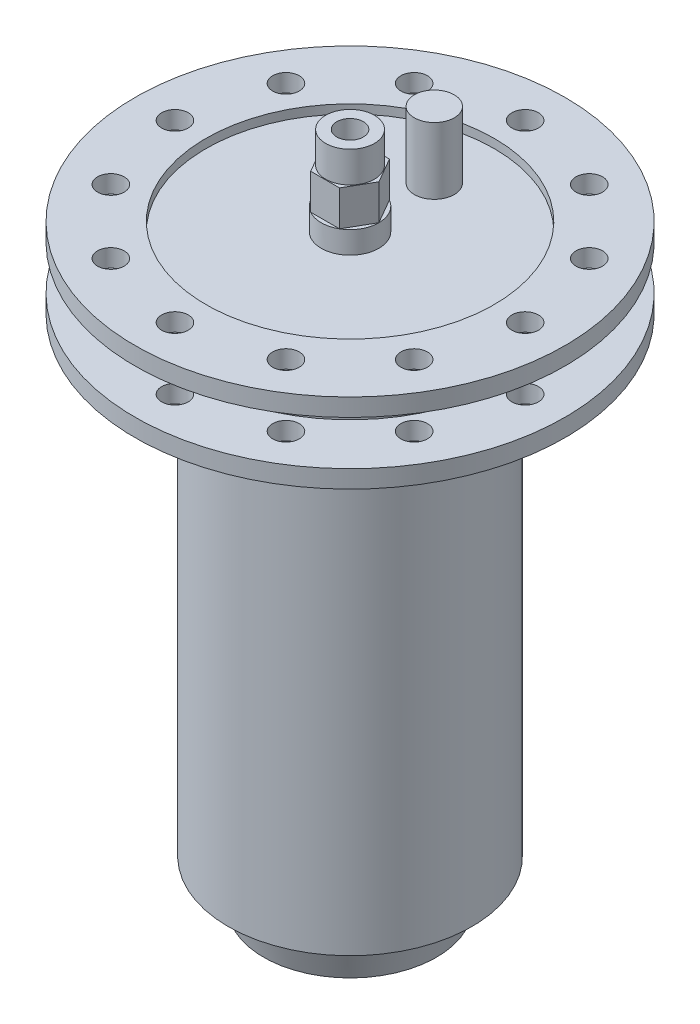
from build123d import *

# Parameters (mm, degrees)
SKETCH_2_W                = 16
SKETCH_2_H                = 4
SKETCH_3_R                = 3
CUT_EXTRUDE_1_DEPTH       = 10
PATTERN_CIRCULAR_1_COUNT  = 12
MIRROR_2_COPY_1_SKETCH_R  = 3
MIRROR_2_COPY_1_DEPTH     = 10
MIRROR_2_COPY_2_SKETCH_R  = 3
MIRROR_2_COPY_2_DEPTH     = 10
MIRROR_2_COPY_3_SKETCH_R  = 3
MIRROR_2_COPY_3_DEPTH     = 10
MIRROR_2_COPY_4_SKETCH_R  = 3
MIRROR_2_COPY_4_DEPTH     = 10
MIRROR_2_COPY_5_SKETCH_R  = 3
MIRROR_2_COPY_5_DEPTH     = 10
MIRROR_2_COPY_6_SKETCH_R  = 3
MIRROR_2_COPY_6_DEPTH     = 10
MIRROR_2_COPY_7_SKETCH_R  = 3
MIRROR_2_COPY_7_DEPTH     = 10
MIRROR_2_COPY_8_SKETCH_R  = 3
MIRROR_2_COPY_8_DEPTH     = 10
MIRROR_2_COPY_9_SKETCH_R  = 3
MIRROR_2_COPY_9_DEPTH     = 10
MIRROR_2_COPY_10_SKETCH_R = 3
MIRROR_2_COPY_10_DEPTH    = 10
MIRROR_2_COPY_11_SKETCH_R = 3
MIRROR_2_COPY_11_DEPTH    = 10
CUT_EXTRUDE_2_DEPTH       = 8
SKETCH_7_W                = 4.5
SKETCH_7_H                = 15


with BuildPart() as part:
    # Эскиз1 → Повернуть1 (revolve)
    with BuildSketch(Plane.XY, mode=Mode.PRIVATE) as revolve_1_sk:
        Polygon((10, 0), (19.5, 0), (22.5, 10), (27.5, 10), (27.5, 112), (32.5, 112), (32.5, 120), (35, 120), (35, 130), (32.5, 130), (32.5, 132), (0, 132), (0, 20), (5, 20), align=None)
    revolve(revolve_1_sk.sketch.rotate(Axis((0, 0, 0), (0, 1, 0)), 90), axis=Axis((0, 0, 0), (0, 1, 0)))

    # Эскиз2 → Повернуть2 (revolve)
    with BuildSketch(Plane(origin=(0, 0, 0), x_dir=(0, 0, -1), z_dir=(1, 0, 0))):
        with Locations((40.5, 118)):
            Rectangle(SKETCH_2_W, SKETCH_2_H)
    revolve_2 = revolve(axis=Axis((0, 0, 0), (0, 1, 0)))

    # Эскиз3 → Вырез-Вытянуть1 (cut)
    with BuildSketch(Plane(origin=(0, 120, 0), x_dir=(1, 0, 0), z_dir=(0, 1, 0))):
        with Locations(Location((39.5, 0, 0), (0, 0, 270))):
            Circle(SKETCH_3_R)
    cut_extrude_1 = extrude(amount=-CUT_EXTRUDE_1_DEPTH, mode=Mode.SUBTRACT)

    # Круговой массив1: Вырез-Вытянуть1 ×12 about axis
    pattern_circular_1_axis = Axis((0, 0, 0), (0, 1, 0))
    for i in range(1, PATTERN_CIRCULAR_1_COUNT):
        add(cut_extrude_1.rotate(pattern_circular_1_axis, i * 360 / PATTERN_CIRCULAR_1_COUNT), mode=Mode.SUBTRACT)

    # Зеркальное отражение2: Повернуть2, Вырез-Вытянуть1 across plane
    add(revolve_2.mirror(Plane.ZX.offset(125)))
    add(cut_extrude_1.mirror(Plane.ZX.offset(125)), mode=Mode.SUBTRACT)

    # Зеркальное отражение2 copy 1 sketch → Зеркальное отражение2 copy 1 (cut)
    with BuildSketch(Plane(origin=(0, 130, 0), x_dir=(0.8660254037844387, 0, -0.49999999999999994), z_dir=(0, -1, 0))):
        with Locations((39.5, 0)):
            Circle(MIRROR_2_COPY_1_SKETCH_R)
    extrude(amount=-MIRROR_2_COPY_1_DEPTH, mode=Mode.SUBTRACT)

    # Зеркальное отражение2 copy 2 sketch → Зеркальное отражение2 copy 2 (cut)
    with BuildSketch(Plane(origin=(0, 130, 0), x_dir=(0.5000000000000001, 0, -0.8660254037844386), z_dir=(0, -1, 0))):
        with Locations((39.5, 0)):
            Circle(MIRROR_2_COPY_2_SKETCH_R)
    extrude(amount=-MIRROR_2_COPY_2_DEPTH, mode=Mode.SUBTRACT)

    # Зеркальное отражение2 copy 3 sketch → Зеркальное отражение2 copy 3 (cut)
    with BuildSketch(Plane(origin=(0, 130, 0), x_dir=(0, 0, -1), z_dir=(0, -1, 0))):
        with Locations((39.5, 0)):
            Circle(MIRROR_2_COPY_3_SKETCH_R)
    extrude(amount=-MIRROR_2_COPY_3_DEPTH, mode=Mode.SUBTRACT)

    # Зеркальное отражение2 copy 4 sketch → Зеркальное отражение2 copy 4 (cut)
    with BuildSketch(Plane(origin=(0, 130, 0), x_dir=(-0.4999999999999998, 0, -0.8660254037844387), z_dir=(0, -1, 0))):
        with Locations((39.5, 0)):
            Circle(MIRROR_2_COPY_4_SKETCH_R)
    extrude(amount=-MIRROR_2_COPY_4_DEPTH, mode=Mode.SUBTRACT)

    # Зеркальное отражение2 copy 5 sketch → Зеркальное отражение2 copy 5 (cut)
    with BuildSketch(Plane(origin=(0, 130, 0), x_dir=(-0.8660254037844387, 0, -0.49999999999999994), z_dir=(0, -1, 0))):
        with Locations((39.5, 0)):
            Circle(MIRROR_2_COPY_5_SKETCH_R)
    extrude(amount=-MIRROR_2_COPY_5_DEPTH, mode=Mode.SUBTRACT)

    # Зеркальное отражение2 copy 6 sketch → Зеркальное отражение2 copy 6 (cut)
    with BuildSketch(Plane(origin=(0, 130, 0), x_dir=(-1, 0, 0), z_dir=(0, -1, 0))):
        with Locations((39.5, 0)):
            Circle(MIRROR_2_COPY_6_SKETCH_R)
    extrude(amount=-MIRROR_2_COPY_6_DEPTH, mode=Mode.SUBTRACT)

    # Зеркальное отражение2 copy 7 sketch → Зеркальное отражение2 copy 7 (cut)
    with BuildSketch(Plane(origin=(0, 130, 0), x_dir=(-0.8660254037844386, 0, 0.5000000000000001), z_dir=(0, -1, 0))):
        with Locations((39.5, 0)):
            Circle(MIRROR_2_COPY_7_SKETCH_R)
    extrude(amount=-MIRROR_2_COPY_7_DEPTH, mode=Mode.SUBTRACT)

    # Зеркальное отражение2 copy 8 sketch → Зеркальное отражение2 copy 8 (cut)
    with BuildSketch(Plane(origin=(0, 130, 0), x_dir=(-0.5000000000000004, 0, 0.8660254037844384), z_dir=(0, -1, 0))):
        with Locations((39.5, 0)):
            Circle(MIRROR_2_COPY_8_SKETCH_R)
    extrude(amount=-MIRROR_2_COPY_8_DEPTH, mode=Mode.SUBTRACT)

    # Зеркальное отражение2 copy 9 sketch → Зеркальное отражение2 copy 9 (cut)
    with BuildSketch(Plane(origin=(0, 130, 0), x_dir=(0, 0, 1), z_dir=(0, -1, 0))):
        with Locations((39.5, 0)):
            Circle(MIRROR_2_COPY_9_SKETCH_R)
    extrude(amount=-MIRROR_2_COPY_9_DEPTH, mode=Mode.SUBTRACT)

    # Зеркальное отражение2 copy 10 sketch → Зеркальное отражение2 copy 10 (cut)
    with BuildSketch(Plane(origin=(0, 130, 0), x_dir=(0.5000000000000001, 0, 0.8660254037844386), z_dir=(0, -1, 0))):
        with Locations((39.5, 0)):
            Circle(MIRROR_2_COPY_10_SKETCH_R)
    extrude(amount=-MIRROR_2_COPY_10_DEPTH, mode=Mode.SUBTRACT)

    # Зеркальное отражение2 copy 11 sketch → Зеркальное отражение2 copy 11 (cut)
    with BuildSketch(Plane(origin=(0, 130, 0), x_dir=(0.8660254037844384, 0, 0.5000000000000004), z_dir=(0, -1, 0))):
        with Locations((39.5, 0)):
            Circle(MIRROR_2_COPY_11_SKETCH_R)
    extrude(amount=-MIRROR_2_COPY_11_DEPTH, mode=Mode.SUBTRACT)

    # Эскиз4 → Повернуть3 (revolve)
    with BuildSketch(Plane(origin=(0, 0, 0), x_dir=(0, 0, -1), z_dir=(1, 0, 0))):
        Polygon((6.5, 132), (6.5, 145), (5.5, 145), (5.5, 152), (3, 152), (3, 132), align=None)
    revolve(axis=Axis((0, 0, 0), (0, 1, 0)))

    # Эскиз5 → Вырез-Вытянуть2 (cut)
    with BuildSketch(Plane(origin=(0, 145, 0), x_dir=(1, 0, 0), z_dir=(0, 1, 0))):
        with BuildLine():
            Line((-3.25, 5.629165125), (3.25, 5.629165125))
            ThreePointArc((3.25, 5.629165125), (0, 6.5), (-3.25, 5.629165125))
        make_face()
        with BuildLine():
            Line((3.25, 5.629165125), (6.5, 0))
            ThreePointArc((6.5, 0), (5.629165125, 3.25), (3.25, 5.629165125))
        make_face()
        with BuildLine():
            ThreePointArc((3.25, -5.629165125), (5.629165125, -3.25), (6.5, 0))
            Line((6.5, 0), (3.25, -5.629165125))
        make_face()
        with BuildLine():
            ThreePointArc((-3.25, -5.629165125), (0, -6.5), (3.25, -5.629165125))
            Line((3.25, -5.629165125), (-3.25, -5.629165125))
        make_face()
        with BuildLine():
            ThreePointArc((-6.5, 0), (-5.629165125, -3.25), (-3.25, -5.629165125))
            Line((-3.25, -5.629165125), (-6.5, 0))
        make_face()
        with BuildLine():
            Line((-6.5, 0), (-3.25, 5.629165125))
            ThreePointArc((-3.25, 5.629165125), (-5.629165125, 3.25), (-6.5, 0))
        make_face()
    extrude(amount=-CUT_EXTRUDE_2_DEPTH, mode=Mode.SUBTRACT)

    # Эскиз7 → Повернуть5 (revolve)
    with BuildSketch(Plane(origin=(0, 0, 0), x_dir=(0, 0, -1), z_dir=(1, 0, 0))):
        with Locations((21.25, 139.5)):
            Rectangle(SKETCH_7_W, SKETCH_7_H)
    revolve(axis=Axis((0, 132, -19), (0, 1, 0)))


solid = part.part
